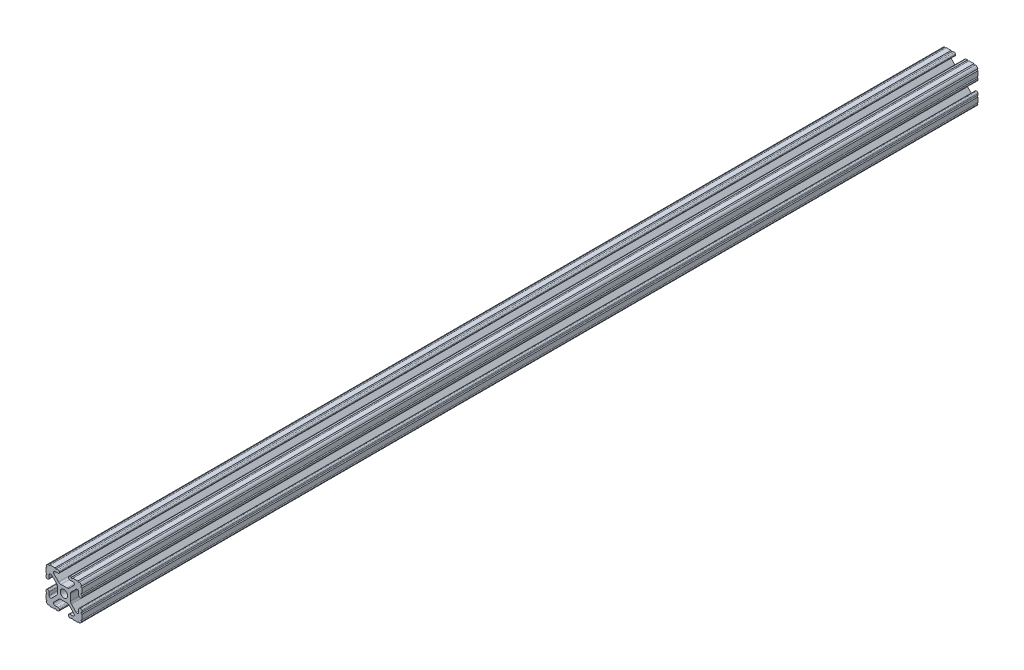
from build123d import *

# Parameters (mm, degrees)
BOSS_EXTRUDE1_DEPTH     = 317.5
CUT_EXTRUDE1_DEPTH      = 319.007594249
CUT_EXTRUDE1_DEPTH_BACK = 319.007594249
SKETCH5_R               = 0.55245


with BuildPart() as part:
    # Sketch4 → Boss-Extrude1 (new, symmetric)
    with BuildSketch(Plane.XY):
        with BuildLine():
            Line((4.190365, -12.7), (10.11729625, -12.7))
            ThreePointArc((10.11729625, -12.7), (11.943543585, -11.943543585), (12.7, -10.11729625))
            Line((12.7, -10.11729625), (12.7, -4.190365))
            ThreePointArc((12.7, -4.190365), (12.42492494, -3.52627506), (11.760835, -3.2512))
            Line((11.760835, -3.2512), (11.429365, -3.2512))
            ThreePointArc((11.429365, -3.2512), (10.76527506, -3.52627506), (10.4902, -4.190365))
            Line((10.4902, -4.190365), (10.4902, -6.348478019))
            ThreePointArc((10.4902, -6.348478019), (9.830707141, -7.335478831), (8.666460301, -7.103895736))
            Line((8.666460301, -7.103895736), (5.299899128, -3.737334563))
            ThreePointArc((5.299899128, -3.737334563), (4.817571085, -3.015479634), (4.6482, -2.16399369))
            Line((4.6482, -2.16399369), (4.6482, 0))
            Line((4.6482, 0), (2.6035, 0))
            ThreePointArc((2.6035, 0), (1.840952505, -1.840952505), (0, -2.6035))
            Line((0, -2.6035), (0, -4.6482))
            Line((0, -4.6482), (2.16399369, -4.6482))
            ThreePointArc((2.16399369, -4.6482), (3.015479634, -4.817571085), (3.737334563, -5.299899128))
            Line((3.737334563, -5.299899128), (7.103895736, -8.666460301))
            ThreePointArc((7.103895736, -8.666460301), (7.335478831, -9.830707141), (6.348478019, -10.4902))
            Line((6.348478019, -10.4902), (4.190365, -10.4902))
            ThreePointArc((4.190365, -10.4902), (3.52627506, -10.76527506), (3.2512, -11.429365))
            Line((3.2512, -11.429365), (3.2512, -11.760835))
            ThreePointArc((3.2512, -11.760835), (3.52627506, -12.42492494), (4.190365, -12.7))
        make_face()
    extrude(amount=BOSS_EXTRUDE1_DEPTH, both=True)

    # Sketch5 → Cut-Extrude1 (cut, two sides: drawn at the far end of the back side and taken through both)
    with BuildSketch(Plane.XY.offset(-CUT_EXTRUDE1_DEPTH_BACK)):
        with Locations((10.356153152, -12.7)):
            Circle(SKETCH5_R)
        with Locations((5.796028019, -12.7)):
            Circle(SKETCH5_R)
        with Locations((12.7, -10.356153152)):
            Circle(SKETCH5_R)
        with Locations((12.7, -5.796028019)):
            Circle(SKETCH5_R)
    extrude(amount=CUT_EXTRUDE1_DEPTH + CUT_EXTRUDE1_DEPTH_BACK, mode=Mode.SUBTRACT)

    # Mirror1: part across plane


with BuildPart() as part_1:
    add(part.part)
    add(part.part.mirror(Plane(origin=(0, 0, 0), x_dir=(0, 0, 1), z_dir=(1, 0, 0))))

    # Mirror2: part across plane


with BuildPart() as part_2:
    add(part_1.part)
    add(part_1.part.mirror(Plane.ZX))


solid = part_2.part
